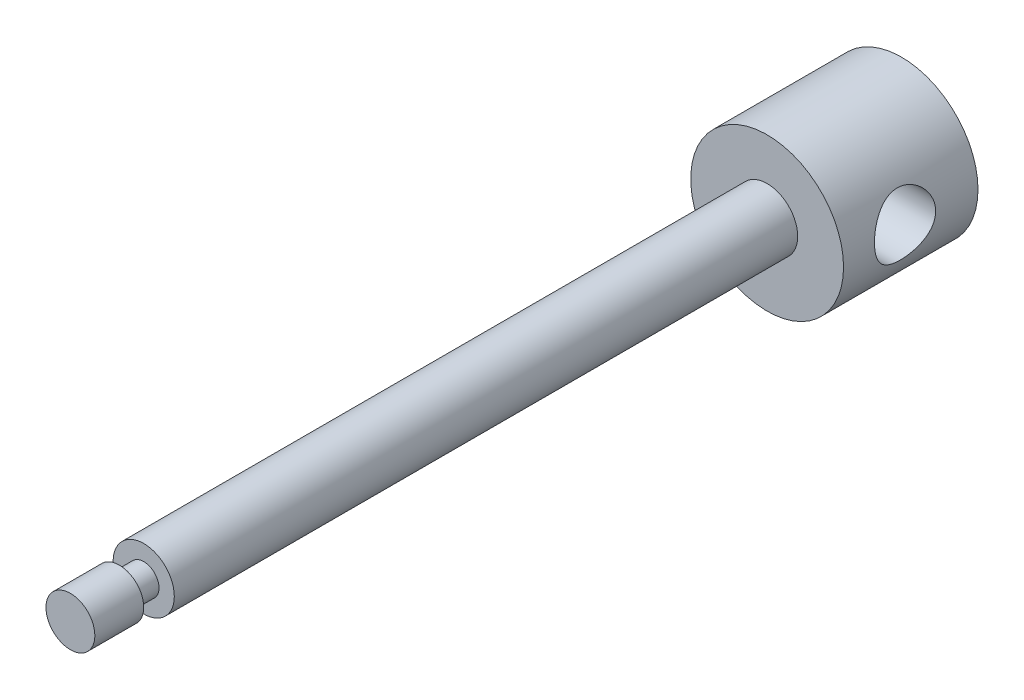
from build123d import *

# Parameters (mm, degrees)
SKETCH4_R           = 12.5
BOSS_EXTRUDE3_DEPTH = 22
SKETCH5_R           = 5
CUT_EXTRUDE1_DEPTH  = 37
SKETCH6_R           = 5
BOSS_EXTRUDE4_DEPTH = 102
SKETCH7_R           = 2.5
BOSS_EXTRUDE5_DEPTH = 4
SKETCH8_R           = 4
BOSS_EXTRUDE6_DEPTH = 8


with BuildPart() as part:
    # Sketch4 → Boss-Extrude3 (new body)
    with BuildSketch(Plane.XY):
        with Locations((0, 1.214400682)):
            Circle(SKETCH4_R)
    extrude(amount=BOSS_EXTRUDE3_DEPTH)

    # Sketch5 → Cut-Extrude1 (cut)
    with BuildSketch(Plane(origin=(13, 0, 0), x_dir=(0, 0, -1), z_dir=(1, 0, 0))):
        with Locations((-11.919301613, 1.755166336)):
            Circle(SKETCH5_R)
    extrude(amount=-CUT_EXTRUDE1_DEPTH, mode=Mode.SUBTRACT)

    # Sketch6 → Boss-Extrude4 (add)
    with BuildSketch(Plane.XY.offset(22)):
        with Locations((0, 1.805272807)):
            Circle(SKETCH6_R)
    extrude(amount=BOSS_EXTRUDE4_DEPTH)

    # Sketch7 → Boss-Extrude5 (add)
    with BuildSketch(Plane.XY.offset(124)):
        with Locations((0, 1.74135251)):
            Circle(SKETCH7_R)
    extrude(amount=BOSS_EXTRUDE5_DEPTH)

    # Sketch8 → Boss-Extrude6 (add)
    with BuildSketch(Plane.XY.offset(128)):
        with Locations((0, 1.74135251)):
            Circle(SKETCH8_R)
    extrude(amount=BOSS_EXTRUDE6_DEPTH)


solid = part.part
